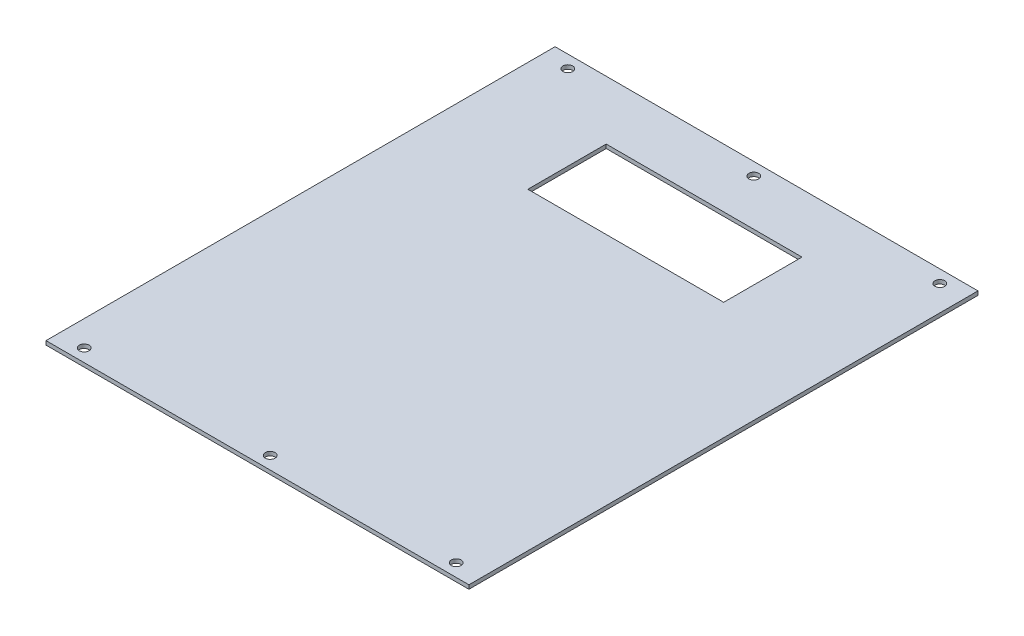
from build123d import *

# Parameters (mm, degrees)
SKETCH_1_W          = 216
SKETCH_1_H          = 260
EXTRUDE_1_DEPTH     = 2
SKETCH_2_W          = 100
SKETCH_2_H          = 40
CUT_EXTRUDE_1_DEPTH = 2
MM_2_D              = 5


with BuildPart() as part:
    # 草图1 → 凸台-拉伸1 (new body)
    with BuildSketch(Plane(origin=(0, 0, 0), x_dir=(1, 0, 0), z_dir=(0, 1, 0))):
        Rectangle(SKETCH_1_W, SKETCH_1_H)
    extrude(amount=EXTRUDE_1_DEPTH)

    # 草图2 → 切除-拉伸1 (cut)
    with BuildSketch(Plane.XZ):
        with Locations((-1.889005497, -80)):
            Rectangle(SKETCH_2_W, SKETCH_2_H)
    extrude(amount=-CUT_EXTRUDE_1_DEPTH, mode=Mode.SUBTRACT)

    # 大小mm 暗销孔2 (through all)
    with Locations(Plane(origin=(45.636831669, 0, 442.05931397), x_dir=(-0.0785283775902434, 0, -0.9969118787099711), z_dir=(0, -1, 0))):
        with Locations((559.93638869, 93.623184237), (567.396584561, -1.08344424), (574.856780432, -95.790072718), (313.699154648, 74.226674972), (321.159350519, -20.479953505), (328.61954639, -115.186581983)):
            Hole(MM_2_D / 2)


solid = part.part
